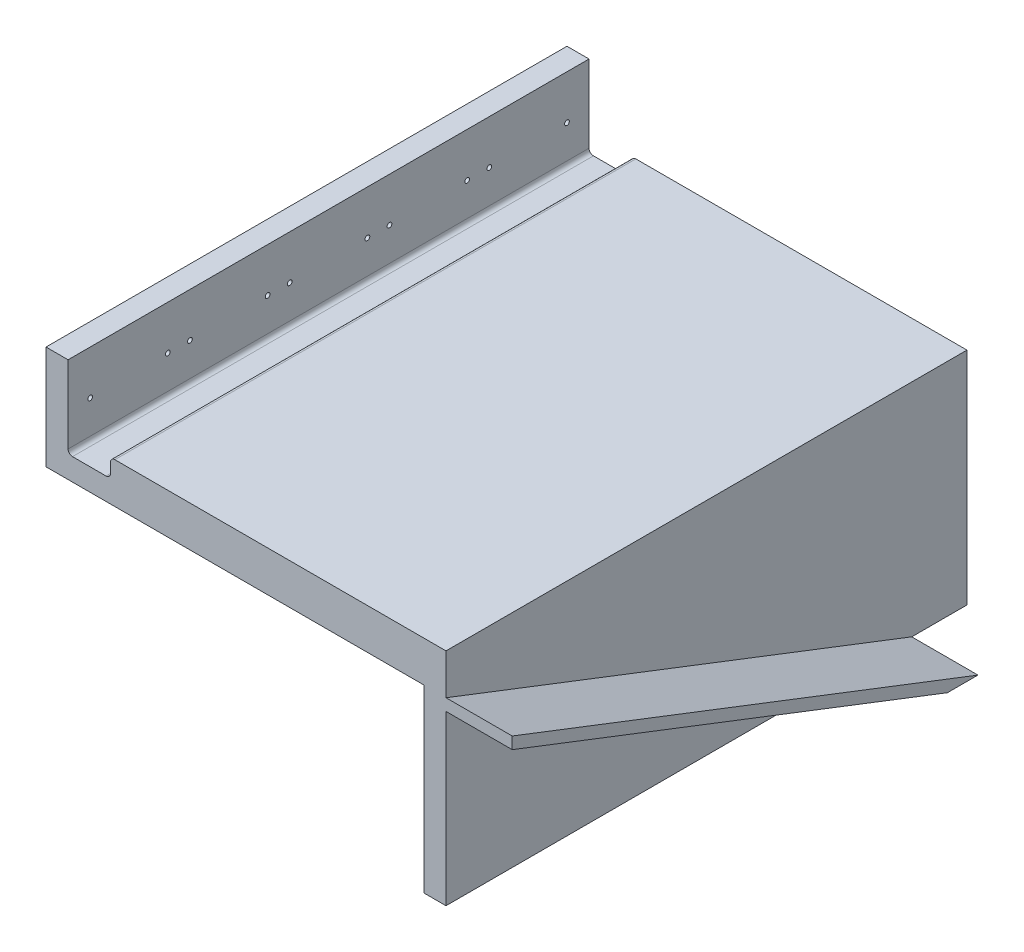
from build123d import *

# Parameters (mm, degrees)
BOSS_EXTRUDE1_DEPTH = 236
SKETCH5_R           = 1.075
CUT_EXTRUDE1_DEPTH  = 85
FILLET1_R           = 2
SKETCH7_W           = 10
SKETCH7_H           = 236
BOSS_EXTRUDE2_DEPTH = 100
BOSS_EXTRUDE3_DEPTH = 30


with BuildPart() as part:
    # Sketch2 → Boss-Extrude1 (new body)
    with BuildSketch(Plane.XY):
        Polygon((0, 0), (0, 22.212686922), (-10, 22.212686922), (-10, -24.787313078), (171.2, -24.787313078), (171.2, -6.387313078), (19.2, -6.387313078), (19.2, -14.787313078), (0, -14.787313078), align=None)
    extrude(amount=BOSS_EXTRUDE1_DEPTH)

    # Sketch5 → Cut-Extrude1 (cut, symmetric)
    with BuildSketch(Plane(origin=(0, 0, 0), x_dir=(0, 0, -1), z_dir=(1, 0, 0))):
        with Locations(Location((-10, 2.212686922, 0), (0, 0, 90))):
            Circle(SKETCH5_R)
        with Locations(Location((-45.2, 2.212686922, 0), (0, 0, 90))):
            Circle(SKETCH5_R)
        with Locations(Location((-55.2, 2.212686922, 0), (0, 0, 90))):
            Circle(SKETCH5_R)
        with Locations(Location((-90.4, 2.212686922, 0), (0, 0, 90))):
            Circle(SKETCH5_R)
        with Locations(Location((-100.4, 2.212686922, 0), (0, 0, 90))):
            Circle(SKETCH5_R)
        with Locations(Location((-135.6, 2.212686922, 0), (0, 0, 90))):
            Circle(SKETCH5_R)
        with Locations(Location((-145.6, 2.212686922, 0), (0, 0, 90))):
            Circle(SKETCH5_R)
        with Locations(Location((-180.8, 2.212686922, 0), (0, 0, 90))):
            Circle(SKETCH5_R)
        with Locations(Location((-190.8, 2.212686922, 0), (0, 0, 90))):
            Circle(SKETCH5_R)
        with Locations(Location((-226, 2.212686922, 0), (0, 0, 90))):
            Circle(SKETCH5_R)
    extrude(amount=CUT_EXTRUDE1_DEPTH, both=True, mode=Mode.SUBTRACT)

    # Fillet1
    fillet1_edges = [part.edges().sort_by_distance(p)[0] for p in [
        (0, -14.787313078, 118),
        (19.2, -14.787313078, 118),
        (19.2, -6.387313078, 118),
    ]]
    fillet(fillet1_edges, radius=FILLET1_R)

    # Sketch7 → Boss-Extrude2 (add)
    with BuildSketch(Plane(origin=(0, -6.387313078, 0), x_dir=(1, 0, 0), z_dir=(0, 1, 0))):
        with Locations((166.2, -118)):
            Rectangle(SKETCH7_W, SKETCH7_H)
    extrude(amount=-BOSS_EXTRUDE2_DEPTH)

    # Sketch8 → Boss-Extrude3 (add)
    with BuildSketch(Plane(origin=(171.2, 0, 0), x_dir=(0, 0, -1), z_dir=(1, 0, 0))):
        Polygon((-236, -24.787313078), (-236, -30.148189832), (-38.862071019, -106.387313078), (-25, -106.387313078), align=None)
    extrude(amount=BOSS_EXTRUDE3_DEPTH)


solid = part.part
